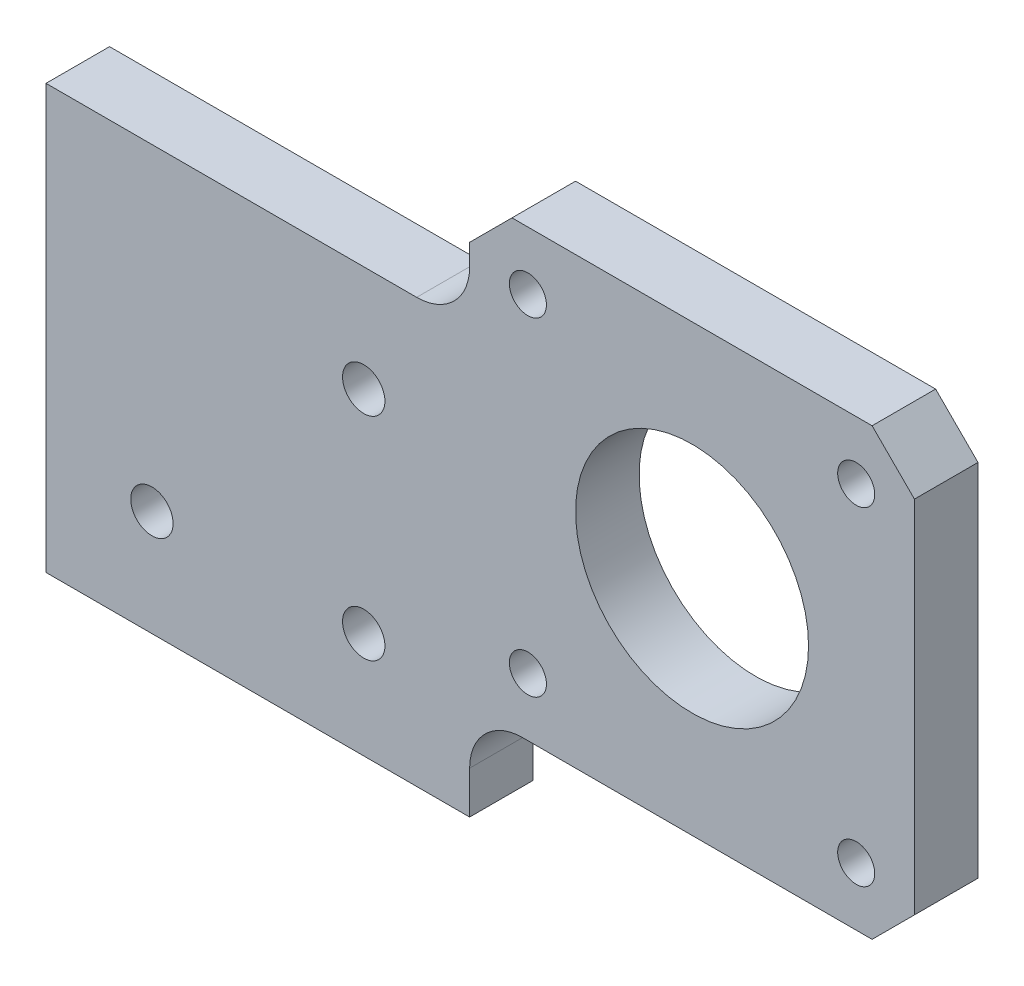
from build123d import *

# Parameters (mm, degrees)
ESBO_O1_W                = 40
ESBO_O1_H                = 40
ESBO_O1_R                = 2
ESBO_O1_R_2              = 1.75
ESBO_O1_R_3              = 11
RESSALTO_EXTRUS_O1_DEPTH = 6
CHANFRO1_SIZE            = 4
FILETE1_R                = 5


with BuildPart() as part:
    # Esboço1 → Ressalto-extrusão1 (new body)
    # profile 1 of 2: a face of its own
    with BuildSketch(Plane.XY):
        with Locations((20, 20)):
            Rectangle(ESBO_O1_W, ESBO_O1_H)
        with Locations((30, 30)):
            Circle(ESBO_O1_R, mode=Mode.SUBTRACT)
        with Locations((10, 10)):
            Circle(ESBO_O1_R, mode=Mode.SUBTRACT)
        with Locations((30, 10)):
            Circle(ESBO_O1_R, mode=Mode.SUBTRACT)
    # profile 2 of 2: a face of its own
    with BuildSketch(Plane.XY):
        Polygon((40, 40), (40, 9), (82, 9), (82, 51), (40, 51), align=None)
        with Locations((45.5, 14.5)):
            Circle(ESBO_O1_R_2, mode=Mode.SUBTRACT)
        with Locations((76.5, 14.5)):
            Circle(ESBO_O1_R_2, mode=Mode.SUBTRACT)
        with Locations((61, 30)):
            Circle(ESBO_O1_R_3, mode=Mode.SUBTRACT)
        with Locations((45.5, 45.5)):
            Circle(ESBO_O1_R_2, mode=Mode.SUBTRACT)
        with Locations((76.5, 45.5)):
            Circle(ESBO_O1_R_2, mode=Mode.SUBTRACT)
    extrude(amount=RESSALTO_EXTRUS_O1_DEPTH)

    # Chanfro1
    chanfro1_edges = [part.edges().sort_by_distance(p)[0] for p in [
        (40, 51, 3),
        (82, 51, 3),
        (82, 9, 3),
    ]]
    chamfer(chanfro1_edges, length=CHANFRO1_SIZE)

    # Filete1
    filete1_edges = [part.edges().sort_by_distance(p)[0] for p in [
        (40, 40, 3),
        (40, 9, 3),
    ]]
    fillet(filete1_edges, radius=FILETE1_R)


solid = part.part
